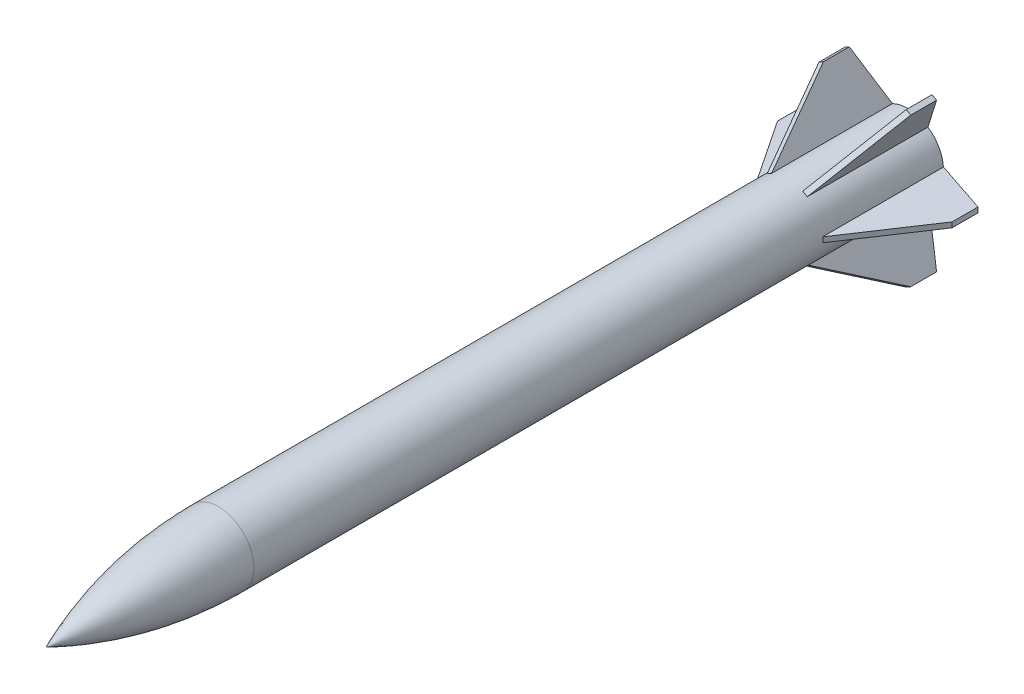
from build123d import *

# Parameters (mm, degrees)
SKETCH1_R           = 41.3
BOSS_EXTRUDE1_DEPTH = 800
BOSS_EXTRUDE2_DEPTH = 3
CIRPATTERN1_COUNT   = 6


with BuildPart() as part:
    # Sketch1 → Boss-Extrude1 (new body)
    with BuildSketch(Plane.XY):
        Circle(SKETCH1_R)
    extrude(amount=BOSS_EXTRUDE1_DEPTH)

    # Sketch2 → Revolve1 (revolve)
    with BuildSketch(Plane(origin=(0, 0, 0), x_dir=(0, 0, -1), z_dir=(1, 0, 0))):
        with BuildLine():
            Line((-800, 0), (-1000, 0))
            ThreePointArc((-1000, 0), (-902.109855058, 30.867215778), (-800, 41.3))
            Line((-800, 41.3), (-800, 0))
        make_face()
    revolve(axis=Axis((0, 0, 800), (0, 0, 1)))

    # Sketch3 → Boss-Extrude2 (add, symmetric)
    with BuildSketch(Plane(origin=(0, 0, 0), x_dir=(1, 0, 0), z_dir=(0, 1, 0))):
        Polygon((41.3, -140), (101.3, -50), (101.3, -20), (41.3, 0), (0, 0), (0, -140), align=None)
    boss_extrude2 = extrude(amount=BOSS_EXTRUDE2_DEPTH, both=True)

    # CirPattern1: Boss-Extrude2 ×6 about axis
    cirpattern1_axis = Axis((0, 0, 0), (0, 0, 1))
    for i in range(1, CIRPATTERN1_COUNT):
        add(boss_extrude2.rotate(cirpattern1_axis, i * 360 / CIRPATTERN1_COUNT))


solid = part.part
